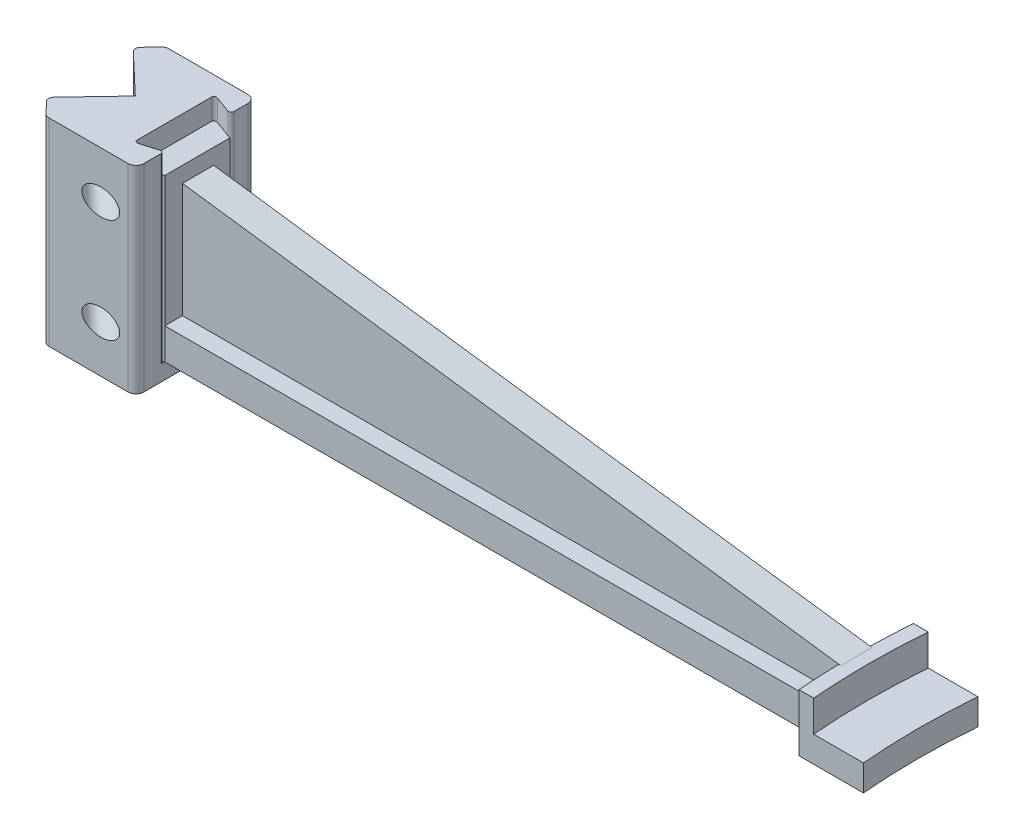
from build123d import *

# Parameters (mm, degrees)
BOSS_EXTRUDE2_DEPTH       = 12
BOSS_EXTRUDE3_START       = -2
BOSS_EXTRUDE3_DEPTH       = 10
BOSS_EXTRUDE4_START       = 10
BOSS_EXTRUDE4_DEPTH       = 22
BOSS_EXTRUDE5_START       = -12
BOSS_EXTRUDE5_DEPTH       = 6
BOSS_EXTRUDE6_START       = -12
BOSS_EXTRUDE6_DEPTH       = 70
BOSS_EXTRUDE7_DEPTH       = 50
BOSS_EXTRUDE17_DEPTH      = 6
BOSS_EXTRUDE17_DEPTH_BACK = 6
CUT_EXTRUDE1_START        = -8
SKETCH5_R                 = 5
CUT_EXTRUDE1_DEPTH        = 235.157775221
SKETCH5_3_R               = 2.75
CUT_EXTRUDE2_DEPTH        = 243.157775221
FILLET1_R                 = 1
FILLET2_R                 = 1
FILLET3_R                 = 3
FILLET4_R                 = 2


with BuildPart() as part:
    # Sketch2 → Boss-Extrude2 (new body)
    with BuildSketch(Plane(origin=(0, 0, 0), x_dir=(1, 0, 0), z_dir=(0, 1, 0))):
        with BuildLine():
            Line((-260.92456554, 15.490671542), (-260.92456554, -15.490671542))
            Line((-260.92456554, -15.490671542), (-251.92456554, -12.785060566))
            Line((-251.92456554, -12.785060566), (0.283618359, -12.5))
            ThreePointArc((0.283618359, -12.5), (0.540536002, -17.252572707), (0.879487479, -22))
            Line((0.879487479, -22), (6.497788935, -22))
            ThreePointArc((6.497788935, -22), (5.6, 0), (6.497788935, 22))
            Line((6.497788935, 22), (0.879487479, 22))
            ThreePointArc((0.879487479, 22), (0.540536002, 17.252572707), (0.283618359, 12.5))
            Line((0.283618359, 12.5), (-251.92456554, 12.214939434))
            Line((-251.92456554, 12.214939434), (-260.92456554, 15.490671542))
        make_face()
    extrude(amount=-BOSS_EXTRUDE2_DEPTH)

    # Sketch2<5> → Boss-Extrude3 (add)
    with BuildSketch(Plane(origin=(0, 0, 0), x_dir=(1, 0, 0), z_dir=(0, 1, 0)).offset(BOSS_EXTRUDE3_START)):
        with BuildLine():
            Line((25.606156876, 22), (6.497788935, 22))
            ThreePointArc((6.497788935, 22), (5.6, 0), (6.497788935, -22))
            Line((6.497788935, -22), (25.606156876, -22))
            ThreePointArc((25.606156876, -22), (24.64, 0), (25.606156876, 22))
        make_face()
    extrude(amount=-BOSS_EXTRUDE3_DEPTH)

    # Sketch2<6> → Boss-Extrude4 (add)
    with BuildSketch(Plane(origin=(0, 0, 0), x_dir=(1, 0, 0), z_dir=(0, 1, 0)).offset(BOSS_EXTRUDE4_START)):
        with BuildLine():
            ThreePointArc((0.879487479, 22), (0.540536002, 17.252572707), (0.283618359, 12.5))
            ThreePointArc((0.283618359, 12.5), (0, 0), (0.283618359, -12.5))
            ThreePointArc((0.283618359, -12.5), (0.540536002, -17.252572707), (0.879487479, -22))
            Line((0.879487479, -22), (6.497788935, -22))
            ThreePointArc((6.497788935, -22), (5.6, 0), (6.497788935, 22))
            Line((6.497788935, 22), (0.879487479, 22))
        make_face()
    extrude(amount=-BOSS_EXTRUDE4_DEPTH)

    # Sketch2<9> → Boss-Extrude7 (add)
    with BuildSketch(Plane(origin=(0, 0, 0), x_dir=(1, 0, 0), z_dir=(0, 1, 0))):
        Polygon((-251.92456554, 12.214939434), (-260.92456554, 12.204767103), (-260.92456554, -12.795232897), (-251.92456554, -12.785060566), align=None)
        Polygon((-260.92456554, 15.490671542), (-260.92456554, 12.204767103), (-251.92456554, 12.214939434), align=None)
        Polygon((-251.92456554, -12.785060566), (-260.92456554, -12.795232897), (-260.92456554, -15.490671542), align=None)
    extrude(amount=BOSS_EXTRUDE7_DEPTH)

    # Sketch4 → Boss-Extrude17 (add, two sides: drawn at the far end of the back side and taken through both)
    with BuildSketch(Plane.XY.offset(-BOSS_EXTRUDE17_DEPTH_BACK)):
        Polygon((0.879487479, 10), (-251.92456554, 44), (-251.92456554, 0), (0.879487479, 0), align=None)
    extrude(amount=BOSS_EXTRUDE17_DEPTH + BOSS_EXTRUDE17_DEPTH_BACK)

    # Fillet2
    fillet2_edges = [part.edges().sort_by_distance(p)[0] for p in [
        (-260.92456554, 19, 15.490671542),
        (-260.92456554, 19, -15.490671542),
    ]]
    fillet(fillet2_edges, radius=FILLET2_R)


with BuildPart() as body_2:
    # Sketch2<7> → Boss-Extrude5 (new body)
    with BuildSketch(Plane(origin=(0, 0, 0), x_dir=(1, 0, 0), z_dir=(0, 1, 0)).offset(BOSS_EXTRUDE5_START)):
        Polygon((-251.92456554, -23.850407561), (-251.92456554, 22.149592439), (-286.510767905, 22.149592439), (-292.596610314, 15.743442535), (-276.02456554, 0), (-292.596610314, -17.444257657), (-286.510767905, -23.850407561), align=None)
    extrude(amount=-BOSS_EXTRUDE5_DEPTH)

    # Sketch2<8> → Boss-Extrude6 (add)
    with BuildSketch(Plane(origin=(0, 0, 0), x_dir=(1, 0, 0), z_dir=(0, 1, 0)).offset(BOSS_EXTRUDE6_START)):
        Polygon((-292.596610314, 15.743442535), (-276.02456554, 0), (-292.596610314, -17.444257657), (-286.510767905, -23.850407561), (-251.92456554, -23.850407561), (-251.92456554, -12.889481563), (-261.02456554, -15.625154883), (-261.02456554, 15.633486343), (-251.92456554, 12.321357211), (-251.92456554, 22.149592439), (-286.510767905, 22.149592439), align=None)
    extrude(amount=BOSS_EXTRUDE6_DEPTH)

    # Sketch5 → Cut-Extrude1 (cut, through all)
    with BuildSketch(Plane(origin=(-145.085185566, 0, -137.830926288), x_dir=(-0.6887494619146907, 0, 0.724999433594416), z_dir=(-0.724999433594416, 0, -0.6887494619146907)).offset(CUT_EXTRUDE1_START)):
        with Locations((200.111770991, 40)):
            Circle(SKETCH5_R)
        with Locations((200.111770991, 0)):
            Circle(SKETCH5_R)
    cut_extrude1 = extrude(amount=-CUT_EXTRUDE1_DEPTH, mode=Mode.SUBTRACT)

    # Sketch5<3> → Cut-Extrude2 (cut, symmetric)
    with BuildSketch(Plane(origin=(-145.085185566, 0, -137.830926288), x_dir=(-0.6887494619146907, 0, 0.724999433594416), z_dir=(-0.724999433594416, 0, -0.6887494619146907))):
        with Locations((200.111770991, 40)):
            Circle(SKETCH5_3_R)
        with Locations((200.111770991, 0)):
            Circle(SKETCH5_3_R)
    cut_extrude2 = extrude(amount=CUT_EXTRUDE2_DEPTH, both=True, mode=Mode.SUBTRACT)

    # Mirror1: Cut-Extrude1, Cut-Extrude2 across plane
    add(cut_extrude1.mirror(Plane.XY), mode=Mode.SUBTRACT)
    add(cut_extrude2.mirror(Plane.XY), mode=Mode.SUBTRACT)

    # Fillet1
    fillet1_edges = [body_2.edges().sort_by_distance(p)[0] for p in [
        (-251.92456554, 23, 12.889481563),
        (-261.02456554, 23, 15.625154883),
        (-261.02456554, 23, -15.633486343),
        (-251.92456554, 23, -12.321357211),
    ]]
    fillet(fillet1_edges, radius=FILLET1_R)

    # Fillet3
    fillet3_edges = [body_2.edges().sort_by_distance(p)[0] for p in [
        (-251.92456554, 20, 23.850407561),
        (-251.92456554, 20, -22.149592439),
        (-286.510767905, 20, -22.149592439),
        (-286.510767905, 20, 23.850407561),
    ]]
    fillet(fillet3_edges, radius=FILLET3_R)

    # Fillet4
    fillet4_edges = [body_2.edges().sort_by_distance(p)[0] for p in [
        (-292.596610314, 20, -15.743442535),
        (-292.596610314, 20, 17.444257657),
    ]]
    fillet(fillet4_edges, radius=FILLET4_R)


solid = Compound([part.part, body_2.part])
